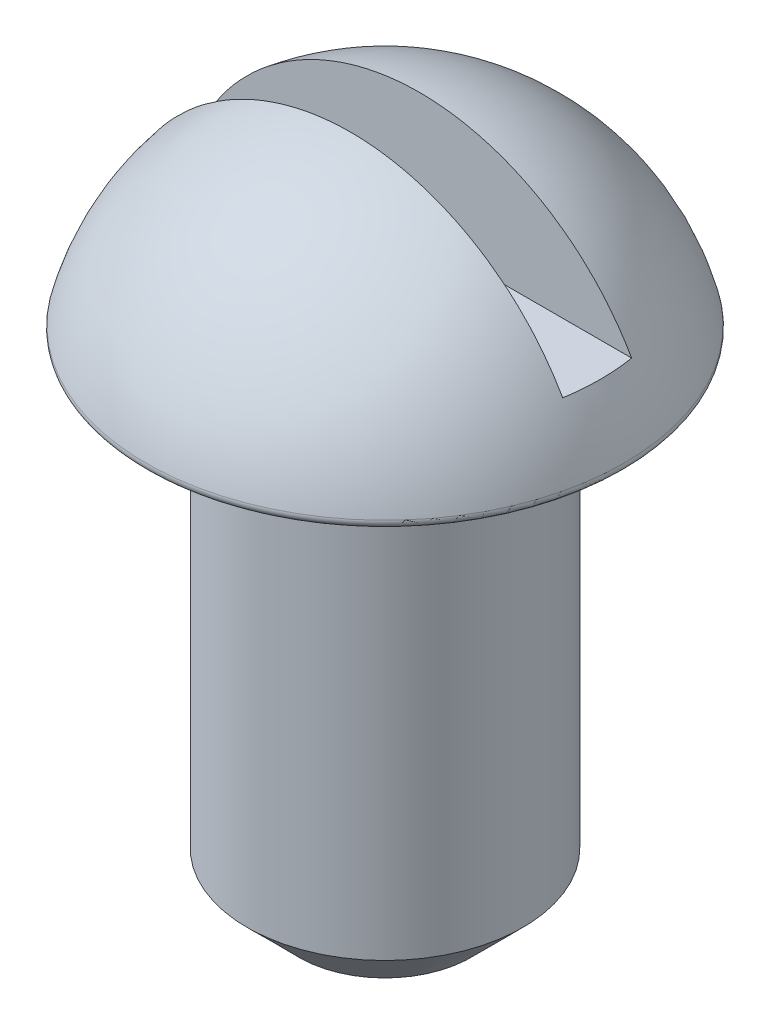
from build123d import *

# Parameters (mm, degrees)
SKETCH_13_W         = 7
SKETCH_13_H         = 1
CUT_EXTRUDE_9_DEPTH = 1.8
FILLET_1_R          = 0.1
CHAMFER_1_SIZE      = 0.75


with BuildPart() as part:
    # Эскиз1 → Повернуть1 (revolve)
    with BuildSketch(Plane.XY):
        with BuildLine():
            Line((2, 91.44931314), (3.5, 91.44931314))
            ThreePointArc((3.5, 91.44931314), (2.438021098, 93.318621459), (0.5, 94.24931314))
            Line((0.5, 94.24931314), (0, 94.24931314))
            Line((0, 94.24931314), (0, 84.24931314))
            Line((0, 84.24931314), (2, 84.24931314))
            Line((2, 84.24931314), (2, 91.44931314))
        make_face()
    revolve(axis=Axis((0, 125.763182898, 0), (0, -1, 0)))

    # Эскиз13 → Вырез-Вытянуть9 (cut)
    with BuildSketch(Plane(origin=(0, 94.24931314, 0), x_dir=(-1, 0, 0), z_dir=(0, 1, 0))):
        Rectangle(SKETCH_13_W, SKETCH_13_H)
    extrude(amount=-CUT_EXTRUDE_9_DEPTH, mode=Mode.SUBTRACT)

    # Скругление1
    fillet_1_edges = [part.edges().sort_by_distance(p)[0] for p in [
        (-3.5, 91.44931314, 0),
    ]]
    fillet(fillet_1_edges, radius=FILLET_1_R)

    # Фаска1
    chamfer_1_edges = [part.edges().sort_by_distance(p)[0] for p in [
        (-2, 84.24931314, 0),
    ]]
    chamfer(chamfer_1_edges, length=CHAMFER_1_SIZE)


solid = part.part
